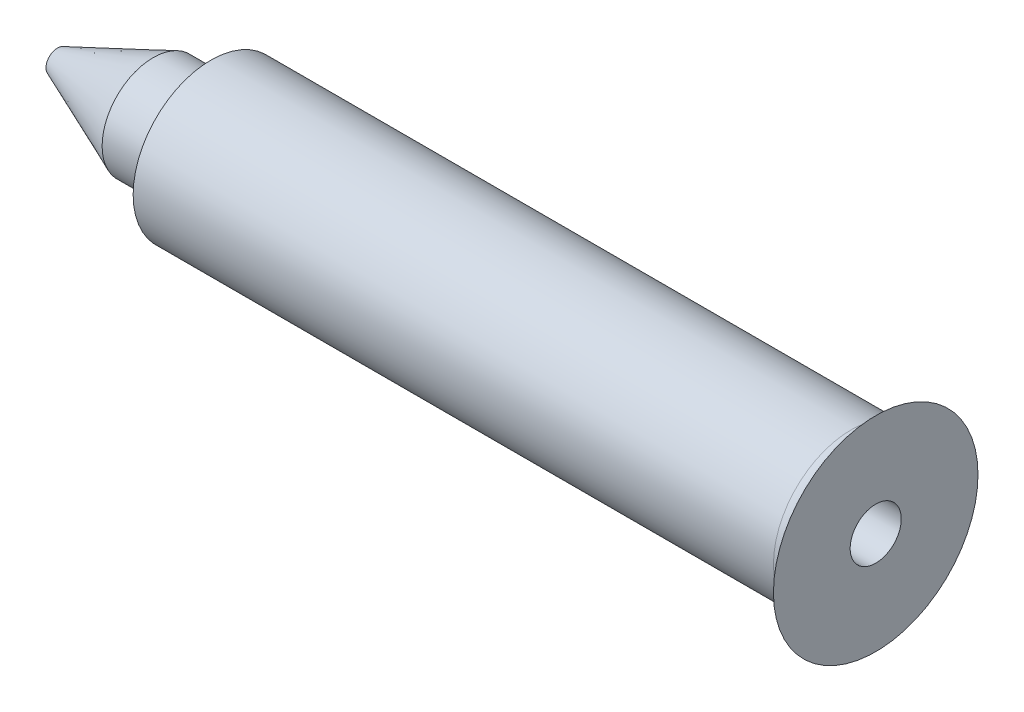
from build123d import *


with BuildPart() as part:
    # Sketch1 → Revolve1 (revolve)
    with BuildSketch(Plane.XY, mode=Mode.PRIVATE) as revolve1_sk:
        with BuildLine():
            Line((0, 0.3556), (1.5875, 0.3556))
            Line((1.5875, 0.3556), (1.5875, 0.79375))
            Line((1.5875, 0.79375), (25.4, 0.79375))
            Line((25.4, 0.79375), (25.4, 2.413))
            Line((25.4, 2.413), (25.4, 3.175))
            ThreePointArc((25.4, 3.175), (25.176815367, 2.636184633), (24.638, 2.413))
            Line((24.638, 2.413), (4.7625, 2.413))
            Line((4.7625, 2.413), (4.7625, 1.5875))
            Line((4.7625, 1.5875), (2.974069687, 1.5875))
            Line((2.974069687, 1.5875), (0, 0.3556))
        make_face()
    revolve(revolve1_sk.sketch.rotate(Axis((0, 0, 0), (1, 0, 0)), 90), axis=Axis((0, 0, 0), (1, 0, 0)))


solid = part.part
